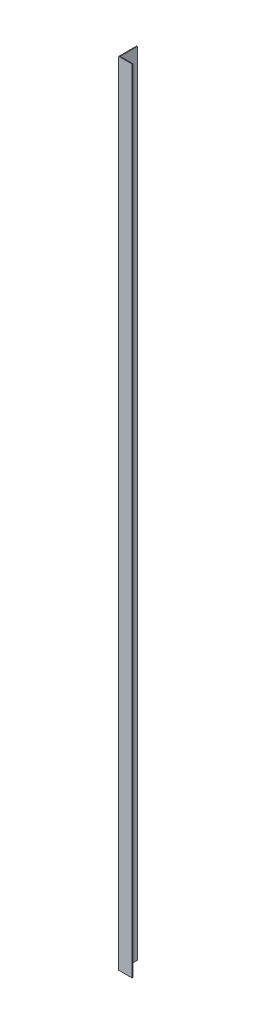
from build123d import *

# Parameters (mm, degrees)
TOPPING_SOVE_SAG_1_START = 200
TOPPING_SOVE_SAG_1_DEPTH = 1770


with BuildPart() as part:
    # Sketch1 → TOPPING_sove_sag_1 (new body)
    with BuildSketch(Plane(origin=(0, 0, 0), x_dir=(1, 0, 0), z_dir=(0, 1, 0)).offset(TOPPING_SOVE_SAG_1_START)):
        Polygon((700, -40), (700, -38.5), (671.5, -38.5), (671.5, 0), (670, 0), (670, -40), align=None)
    extrude(amount=TOPPING_SOVE_SAG_1_DEPTH)


solid = part.part
